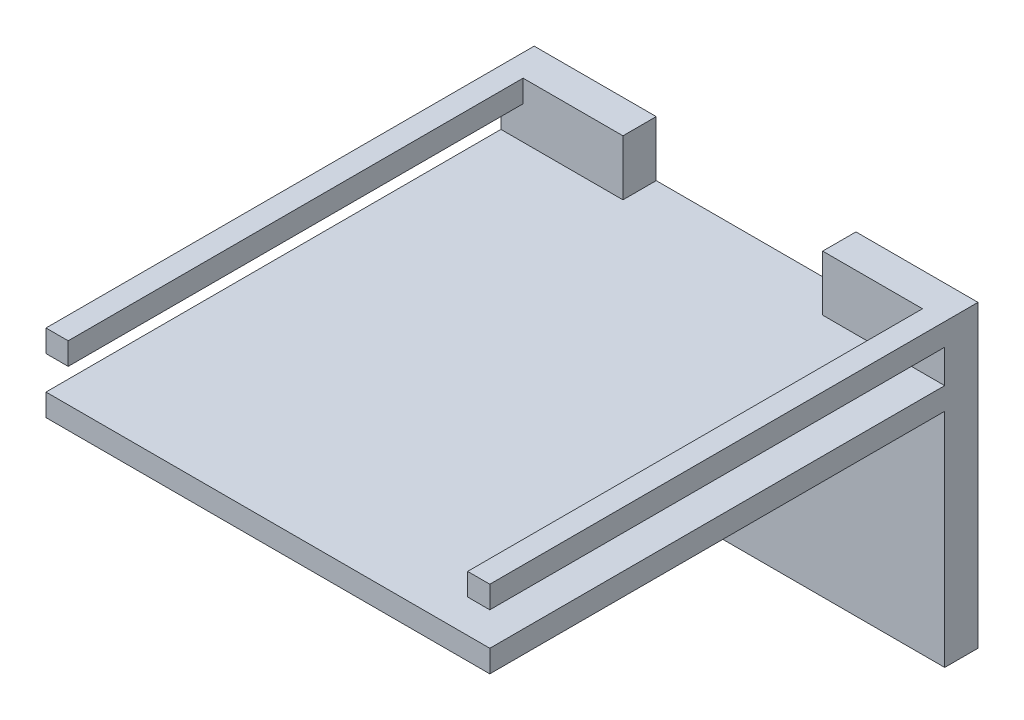
from build123d import *

# Parameters (mm, degrees)
ESBO_O1_W                = 20
ESBO_O1_H                = 3.5
RESSALTO_EXTRUS_O1_DEPTH = 22
ESBO_O2_W                = 18
ESBO_O2_H                = 3.80087929
CORTE_EXTRUS_O1_DEPTH    = 20.5
ESBO_O3_W                = 1
ESBO_O3_H                = 20.5
CORTE_EXTRUS_O2_DEPTH    = 1.5
ESBO_O4_W                = 20
ESBO_O4_H                = 1.5
RESSALTO_EXTRUS_O2_DEPTH = 10
ESBO_O5_R                = 1.5
CORTE_EXTRUS_O3_DEPTH    = 7
ESBO_O6_W                = 9
ESBO_O6_H                = 3.518504599
CORTE_EXTRUS_O4_DEPTH    = 2.5


with BuildPart() as part:
    # Esboço1 → Ressalto-extrusão1 (new body)
    with BuildSketch(Plane.XY):
        with Locations((17.16043247, -2.285464773)):
            Rectangle(ESBO_O1_W, ESBO_O1_H)
    extrude(amount=RESSALTO_EXTRUS_O1_DEPTH)

    # Esboço2 → Corte-extrusão1 (cut)
    with BuildSketch(Plane.XY.offset(22)):
        with Locations((17.16043247, -1.135025128)):
            Rectangle(ESBO_O2_W, ESBO_O2_H)
    extrude(amount=-CORTE_EXTRUS_O1_DEPTH, mode=Mode.SUBTRACT)

    # Esboço3 → Corte-extrusão2 (cut)
    with BuildSketch(Plane(origin=(0, -1.535464773, 0), x_dir=(1, 0, 0), z_dir=(0, 1, 0))):
        with Locations((7.66043247, -11.75)):
            Rectangle(ESBO_O3_W, ESBO_O3_H)
        with Locations((26.66043247, -11.75)):
            Rectangle(ESBO_O3_W, ESBO_O3_H)
    extrude(amount=-CORTE_EXTRUS_O2_DEPTH, mode=Mode.SUBTRACT)

    # Esboço4 → Ressalto-extrusão2 (add)
    with BuildSketch(Plane.XZ.offset(4.035464773)):
        with Locations((17.16043247, 0.75)):
            Rectangle(ESBO_O4_W, ESBO_O4_H)
    extrude(amount=RESSALTO_EXTRUS_O2_DEPTH)

    # Esboço5 → Corte-extrusão3 (cut)
    with BuildSketch(Plane.XY.offset(1.5)):
        with Locations((17.16043247, -9.035464773)):
            Circle(ESBO_O5_R)
    extrude(amount=-CORTE_EXTRUS_O3_DEPTH, mode=Mode.SUBTRACT)

    # Esboço6 → Corte-extrusão4 (cut)
    with BuildSketch(Plane(origin=(0, -0.535464773, 0), x_dir=(1, 0, 0), z_dir=(0, 1, 0))):
        with Locations((17.16043247, -0.984028815)):
            Rectangle(ESBO_O6_W, ESBO_O6_H)
    extrude(amount=-CORTE_EXTRUS_O4_DEPTH, mode=Mode.SUBTRACT)


solid = part.part
